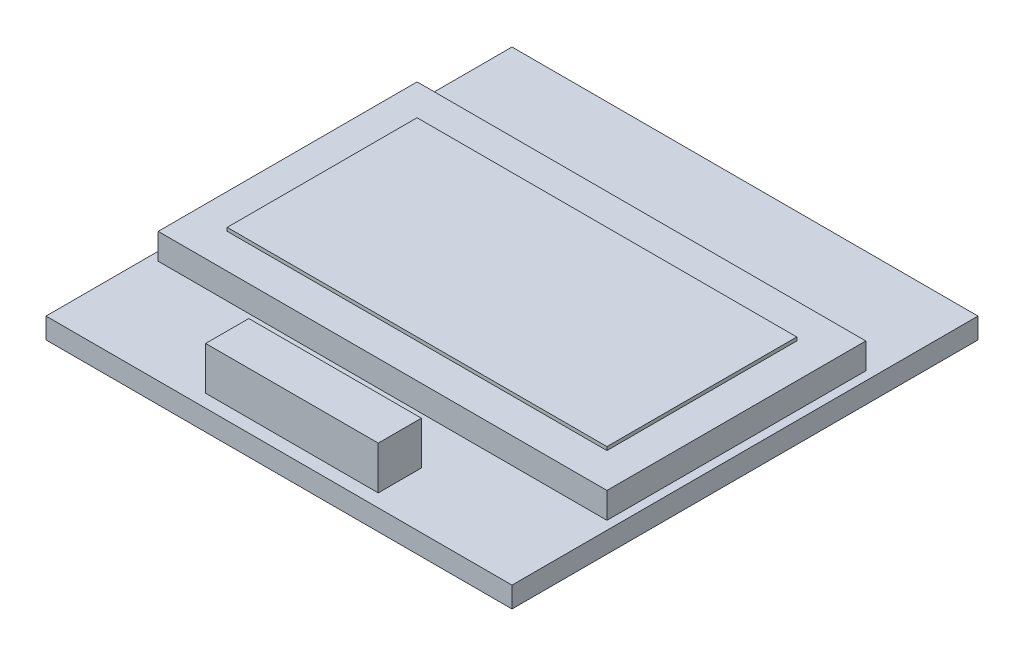
from build123d import *

# Parameters (mm, degrees)
SKETCH1_W         = 27
SKETCH1_H         = 27
PCB_DEPTH         = 1.2
GLASS_START       = 1.2
SKETCH2_W         = 26
SKETCH2_H         = 15
GLASS_DEPTH       = 1.5
ACTIVE_AREA_START = 2.7
SKETCH3_W         = 22
SKETCH3_H         = 11
ACTIVE_AREA_DEPTH = 0.2
HEADER_START      = 1.2
SKETCH4_W         = 10
SKETCH4_H         = 2.5
HEADER_DEPTH      = 2.5


with BuildPart() as part:
    # Sketch1 → PCB (new body)
    with BuildSketch(Plane(origin=(0, 0, 0), x_dir=(1, 0, 0), z_dir=(0, 1, 0))):
        Rectangle(SKETCH1_W, SKETCH1_H)
    extrude(amount=PCB_DEPTH)

    # Sketch2 → Glass (add)
    with BuildSketch(Plane(origin=(0, 0, 0), x_dir=(1, 0, 0), z_dir=(0, 1, 0)).offset(GLASS_START)):
        Rectangle(SKETCH2_W, SKETCH2_H)
    extrude(amount=GLASS_DEPTH)

    # Sketch3 → Active_Area (add)
    with BuildSketch(Plane(origin=(0, 0, 0), x_dir=(1, 0, 0), z_dir=(0, 1, 0)).offset(ACTIVE_AREA_START)):
        Rectangle(SKETCH3_W, SKETCH3_H)
    extrude(amount=ACTIVE_AREA_DEPTH)

    # Sketch4 → Header (add)
    with BuildSketch(Plane(origin=(0, 0, 0), x_dir=(1, 0, 0), z_dir=(0, 1, 0)).offset(HEADER_START)):
        with Locations((0, -11.5)):
            Rectangle(SKETCH4_W, SKETCH4_H)
    extrude(amount=HEADER_DEPTH)


solid = part.part
